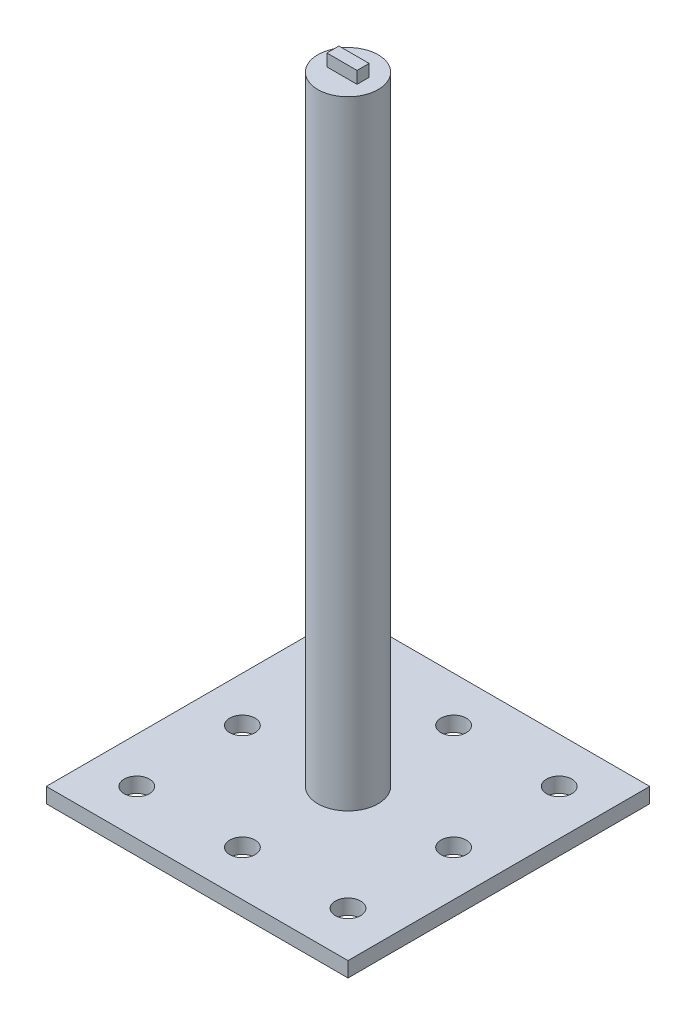
from build123d import *

# Parameters (mm, degrees)
SKETCH1_R                 = 5
SKETCH1_R_2               = 4.5
BOSS_EXTRUDE1_DEPTH       = 100
SKETCH2_R                 = 5
BOSS_EXTRUDE2_DEPTH       = 2.5
SKETCH3_W                 = 50
SKETCH3_H                 = 50
BOSS_EXTRUDE3_DEPTH       = 2.5
M5X0_8_TAPPED_HOLE1_D     = 4.2
M5X0_8_TAPPED_HOLE1_DEPTH = 14
M5X0_8_TAPPED_HOLE1_TIP   = 1.2618073
SKETCH6_W                 = 5
SKETCH6_H                 = 2
BOSS_EXTRUDE5_DEPTH       = 2


with BuildPart() as part:
    # Sketch1 → Boss-Extrude1 (new body)
    with BuildSketch(Plane(origin=(0, 0, 0), x_dir=(1, 0, 0), z_dir=(0, 1, 0))):
        with Locations(Location((0, 0, 0), (0, 0, 270))):
            Circle(SKETCH1_R)
        with Locations(Location((0, 0, 0), (0, 0, 270))):
            Circle(SKETCH1_R_2, mode=Mode.SUBTRACT)
    extrude(amount=BOSS_EXTRUDE1_DEPTH)

    # Sketch2 → Boss-Extrude2 (add)
    with BuildSketch(Plane(origin=(0, 100, 0), x_dir=(1, 0, 0), z_dir=(0, 1, 0))):
        with Locations(Location((0, 0, 0), (0, 0, 270))):
            Circle(SKETCH2_R)
    extrude(amount=BOSS_EXTRUDE2_DEPTH)

    # Sketch3 → Boss-Extrude3 (add)
    with BuildSketch(Plane.XZ):
        Rectangle(SKETCH3_W, SKETCH3_H)
    extrude(amount=BOSS_EXTRUDE3_DEPTH)

    # M5x0.8 Tapped Hole1
    with Locations(Plane(origin=(0, 0, 0), x_dir=(1, 0, 0), z_dir=(0, 1, 0))):
        with Locations((-17.5, 0), (-17.5, -17.5), (0, -17.5), (17.5, -17.5), (17.5, 0), (17.5, 17.5), (0, 17.5), (-17.5, 17.5)):
            Hole(M5X0_8_TAPPED_HOLE1_D / 2, depth=M5X0_8_TAPPED_HOLE1_DEPTH)
            with Locations((0, 0, -(M5X0_8_TAPPED_HOLE1_DEPTH + M5X0_8_TAPPED_HOLE1_TIP / 2))):  # 118° drill point
                Cone(0, M5X0_8_TAPPED_HOLE1_D / 2, M5X0_8_TAPPED_HOLE1_TIP, mode=Mode.SUBTRACT)

    # Sketch6 → Boss-Extrude5 (add)
    with BuildSketch(Plane(origin=(0, 102.5, 0), x_dir=(1, 0, 0), z_dir=(0, 1, 0))):
        Rectangle(SKETCH6_W, SKETCH6_H)
    extrude(amount=BOSS_EXTRUDE5_DEPTH)


solid = part.part
